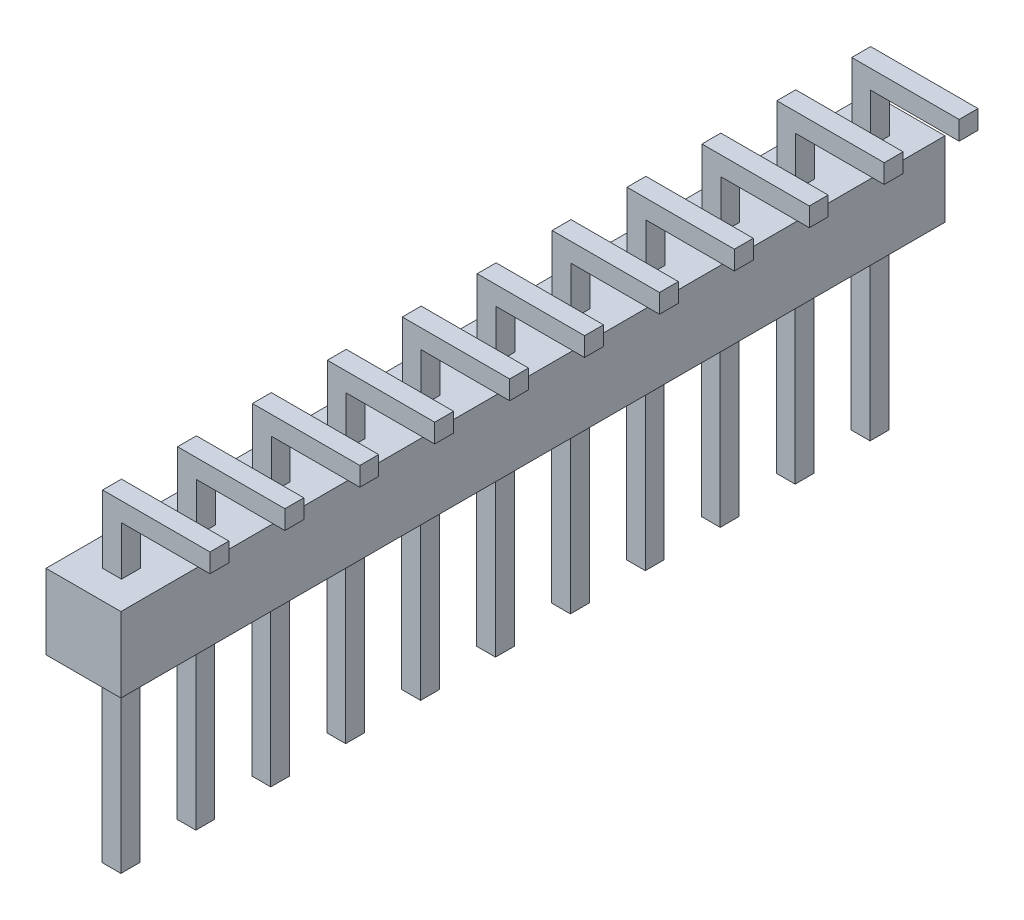
from build123d import *

# Parameters (mm, degrees)
SKETCH1_W           = 2.54
SKETCH1_H           = 2.54
BOSS_EXTRUDE1_DEPTH = 27.94
SKETCH2_W           = 0.64
SKETCH2_H           = 0.64
BOSS_EXTRUDE2_DEPTH = 6.1
LPATTERN1_COUNT     = 11
LPATTERN1_PITCH     = 2.54
SKETCH3_W           = 0.64
SKETCH3_H           = 0.64
BOSS_EXTRUDE3_DEPTH = 2.3
LPATTERN2_COUNT     = 11
LPATTERN2_PITCH     = 2.54
SKETCH4_W           = 0.64
SKETCH4_H           = 0.64
BOSS_EXTRUDE4_DEPTH = 3
LPATTERN3_COUNT     = 11
LPATTERN3_PITCH     = 2.54


with BuildPart() as part:
    # Sketch1 → Boss-Extrude1 (new body)
    with BuildSketch(Plane.XY):
        with Locations((1.27, 1.27)):
            Rectangle(SKETCH1_W, SKETCH1_H)
    extrude(amount=BOSS_EXTRUDE1_DEPTH)

    # Sketch2 → Boss-Extrude2 (add)
    with BuildSketch(Plane.XZ):
        with Locations((1.27, 26.67)):
            Rectangle(SKETCH2_W, SKETCH2_H)
    boss_extrude2 = extrude(amount=BOSS_EXTRUDE2_DEPTH)

    # LPattern1: Boss-Extrude2 ×11
    with Locations(*[(0, 0, -i * LPATTERN1_PITCH) for i in range(1, LPATTERN1_COUNT)]):
        add(boss_extrude2)

    # Sketch3 → Boss-Extrude3 (add)
    with BuildSketch(Plane(origin=(0, 2.54, 0), x_dir=(1, 0, 0), z_dir=(0, 1, 0))):
        with Locations((1.28, -1.26)):
            Rectangle(SKETCH3_W, SKETCH3_H)
    boss_extrude3 = extrude(amount=BOSS_EXTRUDE3_DEPTH)

    # LPattern2: Boss-Extrude3 ×11
    with Locations(*[(0, 0, i * LPATTERN2_PITCH) for i in range(1, LPATTERN2_COUNT)]):
        add(boss_extrude3)

    # Sketch4 → Boss-Extrude4 (add)
    with BuildSketch(Plane(origin=(1.6, 0, 0), x_dir=(0, 0, -1), z_dir=(1, 0, 0))):
        with Locations((-1.26, 4.52)):
            Rectangle(SKETCH4_W, SKETCH4_H)
    boss_extrude4 = extrude(amount=BOSS_EXTRUDE4_DEPTH)

    # LPattern3: Boss-Extrude4 ×11
    with Locations(*[(0, 0, i * LPATTERN3_PITCH) for i in range(1, LPATTERN3_COUNT)]):
        add(boss_extrude4)


solid = part.part
